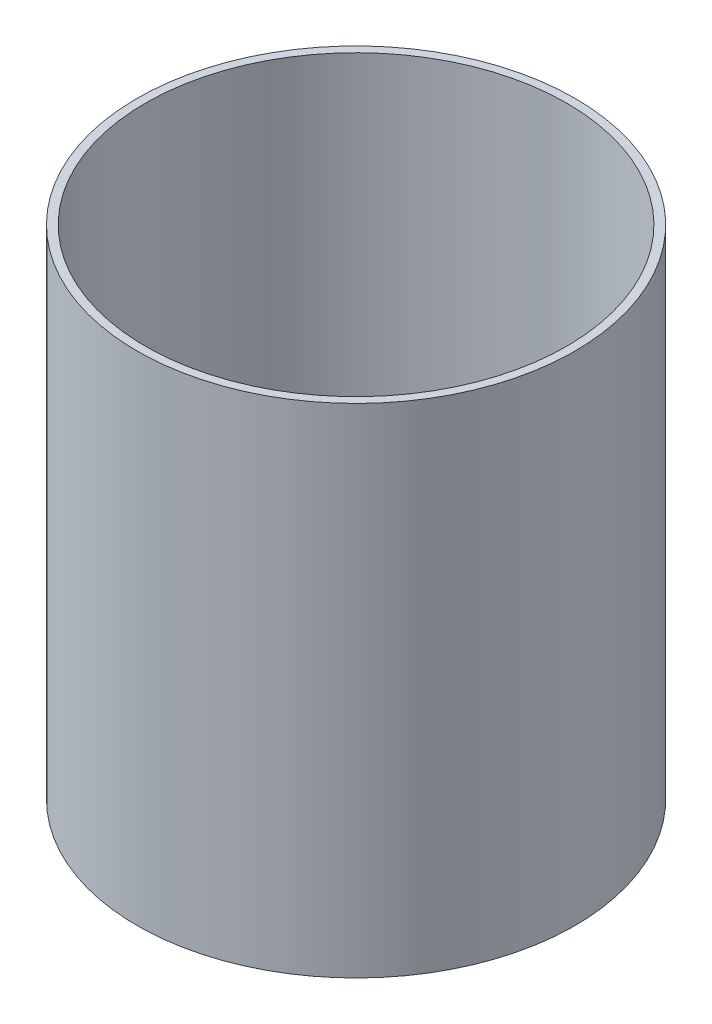
from build123d import *

# Parameters (mm, degrees)
SKETCH1_R           = 39.6
SKETCH1_R_2         = 38.1
BOSS_EXTRUDE1_DEPTH = 90


with BuildPart() as part:
    # Sketch1 → Boss-Extrude1 (new body)
    with BuildSketch(Plane(origin=(0, 0, 0), x_dir=(1, 0, 0), z_dir=(0, 1, 0))):
        with Locations(Location((0, 0, 0), (0, 0, 90))):
            Circle(SKETCH1_R)
        with Locations(Location((0, 0, 0), (0, 0, 90))):
            Circle(SKETCH1_R_2, mode=Mode.SUBTRACT)
    extrude(amount=BOSS_EXTRUDE1_DEPTH)


solid = part.part
